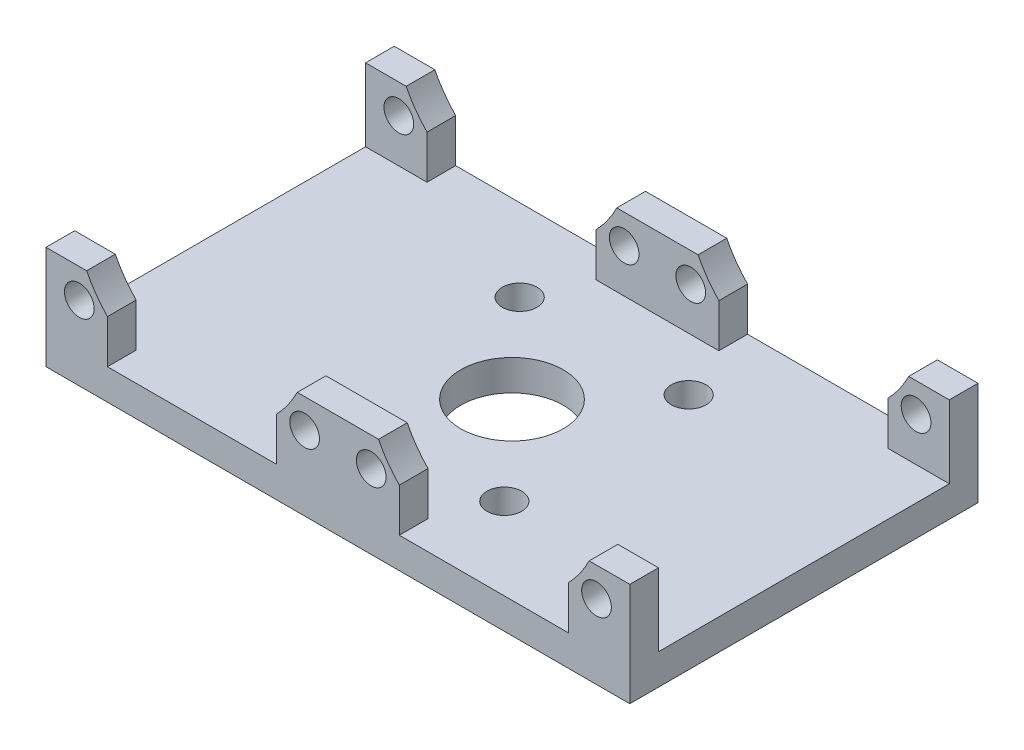
from build123d import *

# Parameters (mm, degrees)
SKETCH1_W           = 57
SKETCH1_H           = 34
SKETCH1_R           = 5
SKETCH1_R_2         = 1.7
BOSS_EXTRUDE1_DEPTH = 3
SKETCH6_R           = 1.45
BOSS_EXTRUDE3_DEPTH = 2.8


with BuildPart() as part:
    # Sketch1 → Boss-Extrude1 (new body)
    with BuildSketch(Plane(origin=(0, 0, 0), x_dir=(1, 0, 0), z_dir=(0, 1, 0))):
        Rectangle(SKETCH1_W, SKETCH1_H)
        with Locations(Location((0, 0, 0), (0, 0, 270))):
            Circle(SKETCH1_R, mode=Mode.SUBTRACT)
        with Locations(Location((-8.25, 9, 0), (0, 0, 270))):
            Circle(SKETCH1_R_2, mode=Mode.SUBTRACT)
        with Locations(Location((8.25, 9, 0), (0, 0, 270))):
            Circle(SKETCH1_R_2, mode=Mode.SUBTRACT)
        with Locations(Location((8.25, -9, 0), (0, 0, 270))):
            Circle(SKETCH1_R_2, mode=Mode.SUBTRACT)
        with Locations(Location((-8.25, -9, 0), (0, 0, 270))):
            Circle(SKETCH1_R_2, mode=Mode.SUBTRACT)
    extrude(amount=BOSS_EXTRUDE1_DEPTH)

    # Sketch6 → Boss-Extrude3 (add)
    # profile 1 of 4: a face of its own
    with BuildSketch(Plane.XY.offset(17)):
        with BuildLine():
            Line((22.5, 7.238289821), (22.5, 3))
            Line((22.5, 3), (28.5, 3))
            Line((28.5, 3), (28.5, 10.1))
            Line((28.5, 10.1), (24.532387855, 10.1))
            ThreePointArc((24.532387855, 10.1), (23.626017075, 8.591148462), (22.5, 7.238289821))
        make_face()
        with Locations((25.25, 7.25)):
            Circle(SKETCH6_R, mode=Mode.SUBTRACT)
    # profile 2 of 4: a face of its own
    with BuildSketch(Plane.XY.offset(17)):
        with BuildLine():
            Line((0, 10.1), (0, 3))
            Line((0, 3), (6, 3))
            Line((6, 3), (6, 7.238289821))
            ThreePointArc((6, 7.238289821), (4.873982925, 8.591148462), (3.967612145, 10.1))
            Line((3.967612145, 10.1), (0, 10.1))
        make_face()
        with Locations((3.25, 7.25)):
            Circle(SKETCH6_R, mode=Mode.SUBTRACT)
    # profile 3 of 4: a face of its own
    with BuildSketch(Plane.XY.offset(17)):
        with BuildLine():
            Line((-6, 7.238289821), (-6, 3))
            Line((-6, 3), (0, 3))
            Line((0, 3), (0, 10.1))
            Line((0, 10.1), (-3.967612145, 10.1))
            ThreePointArc((-3.967612145, 10.1), (-4.873982925, 8.591148462), (-6, 7.238289821))
        make_face()
        with Locations((-3.25, 7.25)):
            Circle(SKETCH6_R, mode=Mode.SUBTRACT)
    # profile 4 of 4: a face of its own
    with BuildSketch(Plane.XY.offset(17)):
        with BuildLine():
            Line((-28.5, 10.1), (-28.5, 3))
            Line((-28.5, 3), (-22.5, 3))
            Line((-22.5, 3), (-22.5, 7.238289821))
            ThreePointArc((-22.5, 7.238289821), (-23.626017075, 8.591148462), (-24.532387855, 10.1))
            Line((-24.532387855, 10.1), (-28.5, 10.1))
        make_face()
        with Locations((-25.25, 7.25)):
            Circle(SKETCH6_R, mode=Mode.SUBTRACT)
    boss_extrude3 = extrude(amount=-BOSS_EXTRUDE3_DEPTH)

    # Mirror2: Boss-Extrude3 across plane
    add(boss_extrude3.mirror(Plane.XY))


solid = part.part
